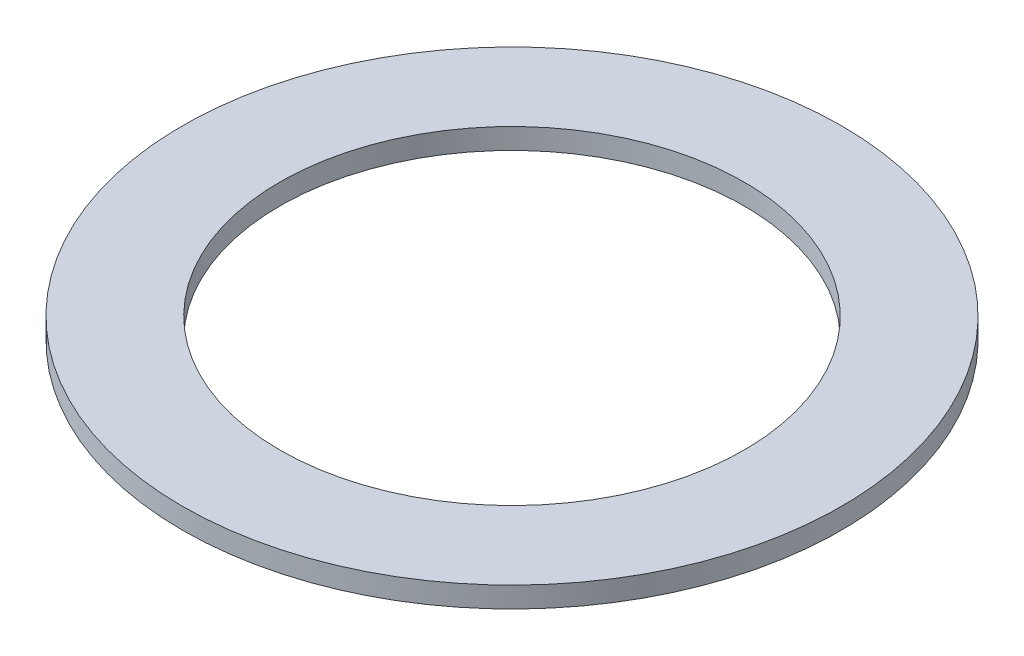
from build123d import *

# Parameters (mm, degrees)
SKIZZE1_R                       = 7.95
SKIZZE1_R_2                     = 5.6
AUFSATZ_LINEAR_AUSTRAGEN1_DEPTH = 0.5


with BuildPart() as part:
    # Skizze1 → Aufsatz-Linear austragen1 (new body)
    with BuildSketch(Plane(origin=(0, 0, 0), x_dir=(1, 0, 0), z_dir=(0, 1, 0))):
        with Locations(Location((0, 0, 0), (0, 0, 270))):
            Circle(SKIZZE1_R)
        with Locations(Location((0, 0, 0), (0, 0, 270))):
            Circle(SKIZZE1_R_2, mode=Mode.SUBTRACT)
    extrude(amount=AUFSATZ_LINEAR_AUSTRAGEN1_DEPTH)


solid = part.part
